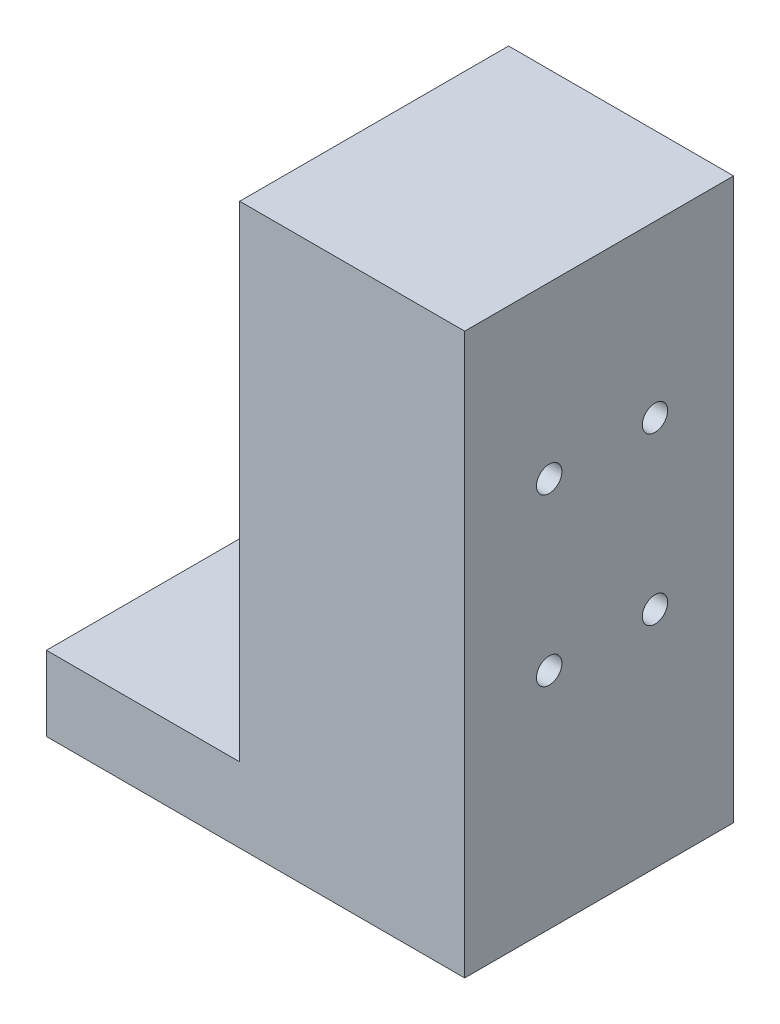
from build123d import *

# Parameters (mm, degrees)
BOSS_EXTRUDE1_DEPTH     = 36
SKETCH2_R               = 2.625
CUT_EXTRUDE1_DEPTH      = 86.658085492
CUT_EXTRUDE2_DEPTH      = 94.206160811
CUT_EXTRUDE2_DEPTH_BACK = 94.206160811
SKETCH3_R               = 1.7


with BuildPart() as part:
    # Sketch1 → Boss-Extrude1 (new body)
    with BuildSketch(Plane.XY):
        Polygon((-42.618160568, 0.233338203), (-42.618160568, -9.766661797), (13.381839432, -9.766661797), (13.381839432, 65.233338203), (-16.742848795, 65.233338203), (-16.742848795, 0.233338203), align=None)
    extrude(amount=BOSS_EXTRUDE1_DEPTH)

    # Sketch2 → Cut-Extrude1 (cut, through all)
    with BuildSketch(Plane(origin=(0, 0.233338203, 0), x_dir=(1, 0, 0), z_dir=(0, 1, 0))):
        with Locations(Location((-29.680504682, -18, 0), (0, 0, 270))):
            Circle(SKETCH2_R)
    extrude(amount=-CUT_EXTRUDE1_DEPTH, mode=Mode.SUBTRACT)

    # Sketch3 → Cut-Extrude2 (cut, two sides: drawn at the far end of the back side and taken through both)
    with BuildSketch(Plane(origin=(13.381839432, 0, 0), x_dir=(0, 0, -1), z_dir=(1, 0, 0)).offset(-CUT_EXTRUDE2_DEPTH_BACK)):
        with Locations((-24.687630005, 20.233338203)):
            Circle(SKETCH3_R)
        with Locations((-10.520088066, 20.233338203)):
            Circle(SKETCH3_R)
        with Locations((-24.687630005, 42.461110081)):
            Circle(SKETCH3_R)
        with Locations((-10.520088066, 42.461110081)):
            Circle(SKETCH3_R)
    extrude(amount=CUT_EXTRUDE2_DEPTH + CUT_EXTRUDE2_DEPTH_BACK, mode=Mode.SUBTRACT)


solid = part.part
